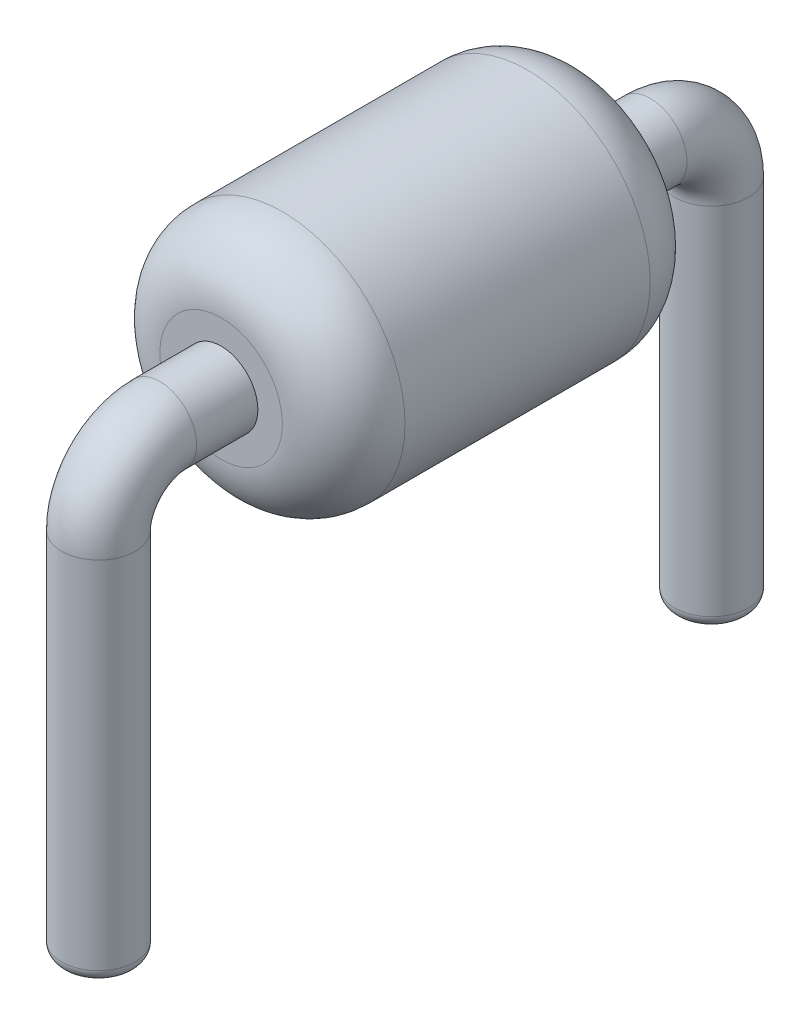
from build123d import *

# Parameters (mm, degrees)
SKETCH3_R           = 0.3
BOSS_EXTRUDE2_START = -3
SKETCH4_R           = 1
SKETCH4_R_2         = 0.3
BOSS_EXTRUDE2_DEPTH = 3
FILLET1_R           = 0.5
FILLET2_R           = 0.1


with BuildPart() as part:
    # Sweep1: sweep along a path in Sketch2
    with BuildLine(Plane(origin=(0, 0, 0), x_dir=(0, 0, -1), z_dir=(1, 0, 0))) as sweep1_path:
        Line((0, 0), (0, 3))
        ThreePointArc((0, 3), (0.146446609, 3.353553391), (0.5, 3.5))
        Line((0.5, 3.5), (4.5, 3.5))
        ThreePointArc((4.5, 3.5), (4.853553391, 3.353553391), (5, 3))
        Line((5, 3), (5, 0))
    # Sketch3 → Sweep1 (sweep)
    with BuildSketch(Plane(origin=(0, 0, 0), x_dir=(1, 0, 0), z_dir=(0, 1, 0))):
        Circle(SKETCH3_R)
    sweep(path=sweep1_path.line)

    # Sketch4 → Boss-Extrude2 (add)
    with BuildSketch(Plane.XY.offset(-1).offset(BOSS_EXTRUDE2_START)):
        with Locations((0, 3.5)):
            Circle(SKETCH4_R)
        with Locations(Location((0, 3.5, 0), (0, 0, 90))):
            Circle(SKETCH4_R_2, mode=Mode.SUBTRACT)
    extrude(amount=BOSS_EXTRUDE2_DEPTH)

    # Fillet1
    fillet1_edges = [part.edges().sort_by_distance(p)[0] for p in [
        (-1, 3.5, -4),
        (-1, 3.5, -1),
    ]]
    fillet(fillet1_edges, radius=FILLET1_R)

    # Fillet2
    fillet2_edges = [part.edges().sort_by_distance(p)[0] for p in [
        (-0.3, 0, 0),
        (-0.3, 0, -5),
    ]]
    fillet(fillet2_edges, radius=FILLET2_R)


solid = part.part
